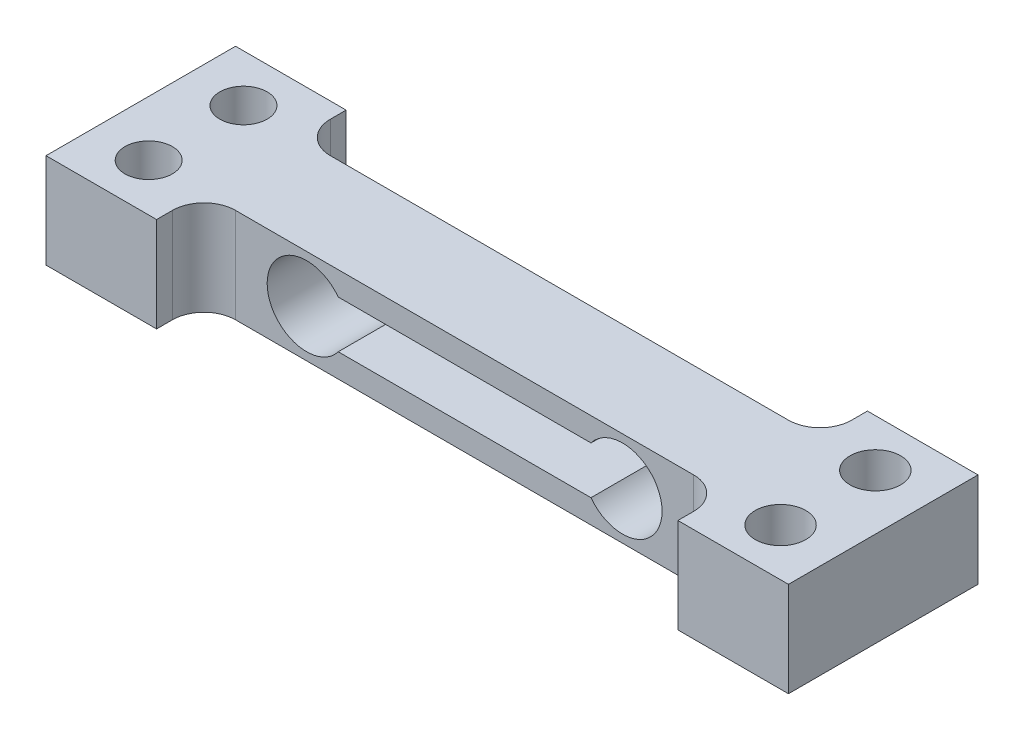
from build123d import *

# Parameters (mm, degrees)
SKETCH1_R           = 1.5
SKETCH1_R_2         = 1.6
BOSS_EXTRUDE2_DEPTH = 6
CUT_EXTRUDE1_DEPTH  = 49.228622207


with BuildPart() as part:
    # Sketch1 → Boss-Extrude2 (new body)
    with BuildSketch(Plane(origin=(0, 0, 0), x_dir=(1, 0, 0), z_dir=(0, 1, 0))):
        with BuildLine():
            Line((40, 0), (47, 0))
            Line((47, 0), (47, 12))
            Line((47, 12), (40, 12))
            Line((40, 12), (40, 11))
            ThreePointArc((40, 11), (39.414213562, 9.585786438), (38, 9))
            Line((38, 9), (9, 9))
            ThreePointArc((9, 9), (7.585786438, 9.585786438), (7, 11))
            Line((7, 11), (7, 12))
            Line((7, 12), (0, 12))
            Line((0, 12), (0, 0))
            Line((0, 0), (7, 0))
            Line((7, 0), (7, 1))
            ThreePointArc((7, 1), (7.585786438, 2.414213562), (9, 3))
            Line((9, 3), (38, 3))
            ThreePointArc((38, 3), (39.414213562, 2.414213562), (40, 1))
            Line((40, 1), (40, 0))
        make_face()
        with Locations(Location((3.5, 9, 0), (0, 0, 270))):
            Circle(SKETCH1_R, mode=Mode.SUBTRACT)
        with Locations(Location((3.5, 3, 0), (0, 0, 270))):
            Circle(SKETCH1_R, mode=Mode.SUBTRACT)
        with Locations(Location((43.5, 9, 0), (0, 0, 270))):
            Circle(SKETCH1_R_2, mode=Mode.SUBTRACT)
        with Locations(Location((43.5, 3, 0), (0, 0, 270))):
            Circle(SKETCH1_R_2, mode=Mode.SUBTRACT)
    extrude(amount=BOSS_EXTRUDE2_DEPTH)

    # Sketch2 → Cut-Extrude1 (cut, through all)
    with BuildSketch(Plane(origin=(0, 0, -9), x_dir=(-1, 0, 0), z_dir=(0, 0, -1))):
        with BuildLine():
            Line((-31.5, 4.5), (-15.5, 4.5))
            ThreePointArc((-15.5, 4.5), (-11, 3), (-15.5, 1.5))
            Line((-15.5, 1.5), (-31.5, 1.5))
            ThreePointArc((-31.5, 1.5), (-36, 3), (-31.5, 4.5))
        make_face()
    extrude(amount=-CUT_EXTRUDE1_DEPTH, mode=Mode.SUBTRACT)


solid = part.part
